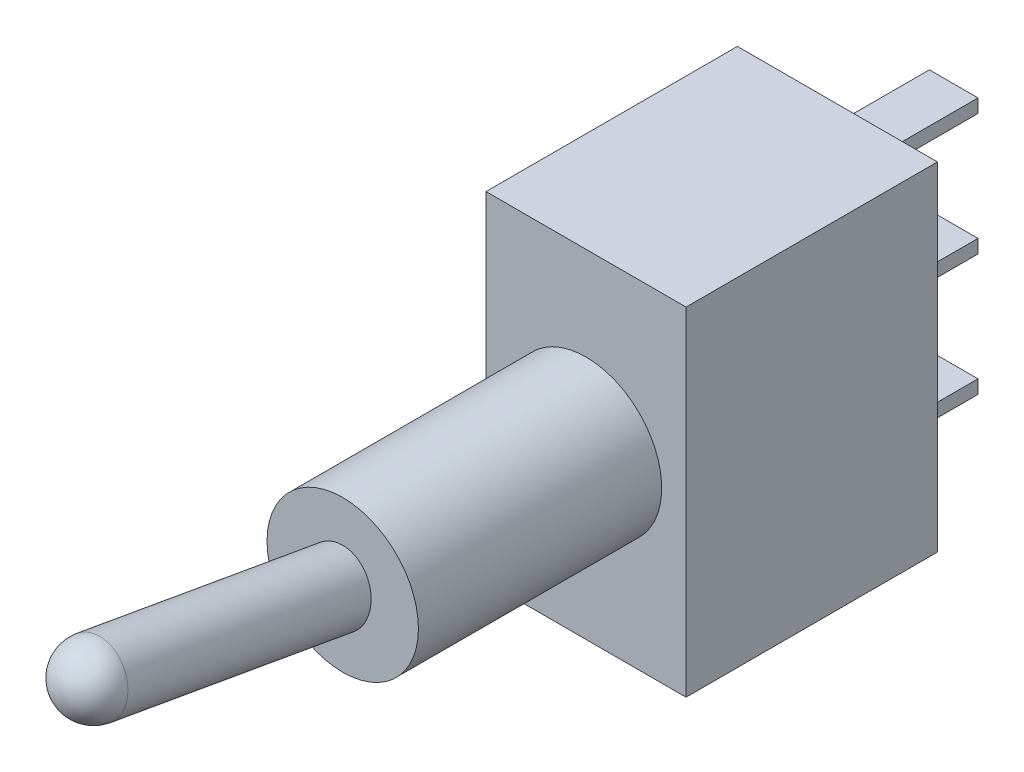
from build123d import *

# Parameters (mm, degrees)
ESQUISSE1_W        = 7.4
ESQUISSE1_H        = 12.5
BOSS_EXTRU_1_DEPTH = 9.3
ESQUISSE2_W        = 1.8
ESQUISSE2_H        = 0.5
BOSS_EXTRU_2_DEPTH = 4.3
ESQUISSE3_R        = 2.8
BOSS_EXTRU_3_DEPTH = 9


with BuildPart() as part:
    # Esquisse1 → Boss.-Extru.1 (new body)
    with BuildSketch(Plane.XY):
        with Locations((3.7, 6.25)):
            Rectangle(ESQUISSE1_W, ESQUISSE1_H)
    extrude(amount=BOSS_EXTRU_1_DEPTH)

    # Esquisse2 → Boss.-Extru.2 (add)
    with BuildSketch(Plane(origin=(0, 0, 0), x_dir=(-1, 0, 0), z_dir=(0, 0, -1))):
        with Locations((-3.7, 1.75)):
            Rectangle(ESQUISSE2_W, ESQUISSE2_H)
        with Locations((-3.7, 6.25)):
            Rectangle(ESQUISSE2_W, ESQUISSE2_H)
        with Locations((-3.7, 10.75)):
            Rectangle(ESQUISSE2_W, ESQUISSE2_H)
    extrude(amount=BOSS_EXTRU_2_DEPTH)

    # Esquisse3 → Boss.-Extru.3 (add)
    with BuildSketch(Plane.XY.offset(9.3)):
        with Locations(Location((3.7, 6.25, 0), (0, 0, 180))):
            Circle(ESQUISSE3_R)
    extrude(amount=BOSS_EXTRU_3_DEPTH)


with BuildPart() as body_2:
    # Esquisse4 → Révolution1 (revolve)
    with BuildSketch(Plane(origin=(3.7, 0, 0), x_dir=(0, 0, -1), z_dir=(1, 0, 0))):
        with BuildLine():
            Line((-18.3, 6.25), (-18.3, 7.519283265))
            Line((-18.3, 7.519283265), (-27.3, 9.106226091))
            ThreePointArc((-27.3, 9.106226091), (-28.234030768, 8.899156455), (-28.748069913, 8.092276622))
            Line((-28.748069913, 8.092276622), (-18.3, 6.25))
        make_face()
    revolve(axis=Axis((3.7, 6.25, 18.3), (0, 0.17364817766693066, 0.984807753012208)))


solid = Compound([part.part, body_2.part])
